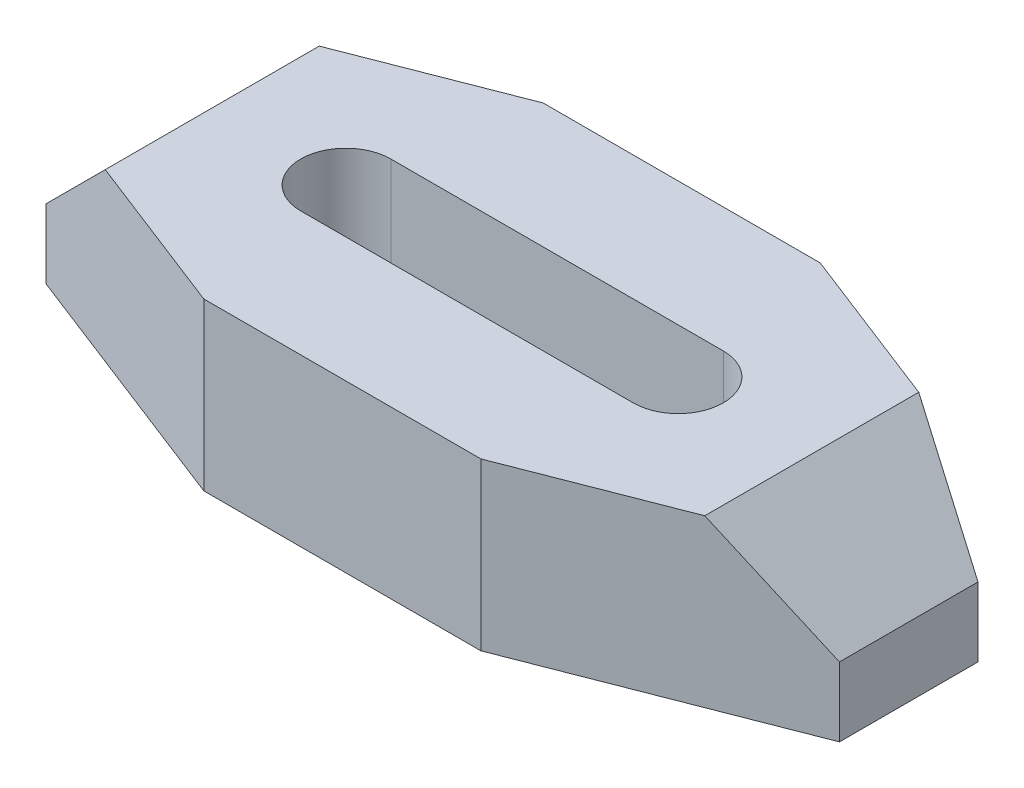
from build123d import *

# Parameters (mm, degrees)
BOSS_EXTRU_2_DEPTH = 2.4
CHANFREIN3_SIZE    = 1.4
CHANFREIN4_SIZE    = 1.4


with BuildPart() as part:
    # Esquisse2 → Boss.-Extru.2 (new body)
    with BuildSketch(Plane(origin=(0, 0, 0), x_dir=(1, 0, 0), z_dir=(0, 1, 0))):
        Polygon((-0.604426001, 3.317657231), (-4.604426001, 3.317657231), (-8.332361087, 1.867657231), (-8.332361087, -0.132342769), (-4.604426001, -1.582342769), (-0.604426001, -1.582342769), (3.123509084, -0.132342769), (3.123509084, 1.867657231), align=None)
        with BuildLine():
            Line((-0.204426001, 1.517657231), (-5.004426001, 1.517657231))
            ThreePointArc((-5.004426001, 1.517657231), (-5.654426001, 0.867657231), (-5.004426001, 0.217657231))
            Line((-5.004426001, 0.217657231), (-0.204426001, 0.217657231))
            ThreePointArc((-0.204426001, 0.217657231), (0.445573999, 0.867657231), (-0.204426001, 1.517657231))
        make_face(mode=Mode.SUBTRACT)
    extrude(amount=BOSS_EXTRU_2_DEPTH)

    # Chanfrein3
    chanfrein3_edges = [part.edges().sort_by_distance(p)[0] for p in [
        (-8.332361087, 2.4, -0.867657231),
    ]]
    chamfer(chanfrein3_edges, length=CHANFREIN3_SIZE)

    # Chanfrein4
    chanfrein4_edges = [part.edges().sort_by_distance(p)[0] for p in [
        (3.123509084, 2.4, -0.867657231),
    ]]
    chamfer(chanfrein4_edges, length=CHANFREIN4_SIZE)


solid = part.part
